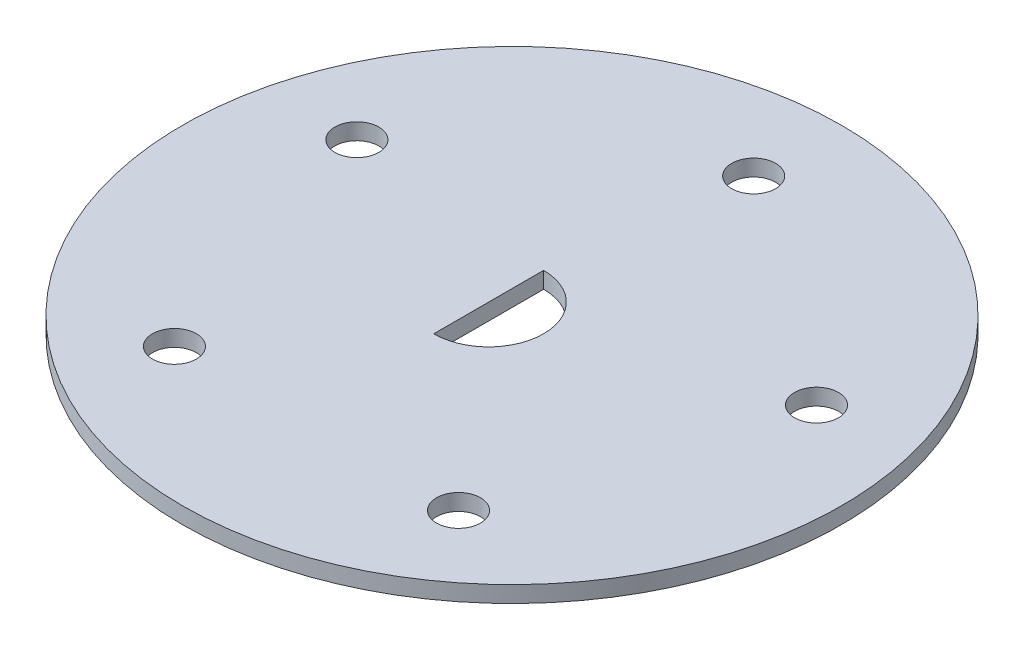
from build123d import *

# Parameters (mm, degrees)
SKETCH1_R           = 38.1
SKETCH1_R_2         = 2.54
BOSS_EXTRUDE1_DEPTH = 1.89738


with BuildPart() as part:
    # Sketch1 → Boss-Extrude1 (new body)
    with BuildSketch(Plane(origin=(0, 0, 0), x_dir=(1, 0, 0), z_dir=(0, 1, 0))):
        with Locations(Location((0, 0, 0), (0, 0, 90))):
            Circle(SKETCH1_R)
        with Locations(Location((0, 27.94, 0), (0, 0, 90))):
            Circle(SKETCH1_R_2, mode=Mode.SUBTRACT)
        with Locations(Location((26.572519065, 8.633934823, 0), (0, 0, 90))):
            Circle(SKETCH1_R_2, mode=Mode.SUBTRACT)
        with Locations(Location((16.422719949, -22.603934823, 0), (0, 0, 90))):
            Circle(SKETCH1_R_2, mode=Mode.SUBTRACT)
        with Locations(Location((-16.422719949, -22.603934823, 0), (0, 0, 90))):
            Circle(SKETCH1_R_2, mode=Mode.SUBTRACT)
        with Locations(Location((-26.572519065, 8.633934823, 0), (0, 0, 90))):
            Circle(SKETCH1_R_2, mode=Mode.SUBTRACT)
        with BuildLine():
            Line((-2.695023706, 6.35), (-2.695023706, -6.35))
            ThreePointArc((-2.695023706, -6.35), (3.654976294, 0), (-2.695023706, 6.35))
        make_face(mode=Mode.SUBTRACT)
    extrude(amount=BOSS_EXTRUDE1_DEPTH)


solid = part.part
